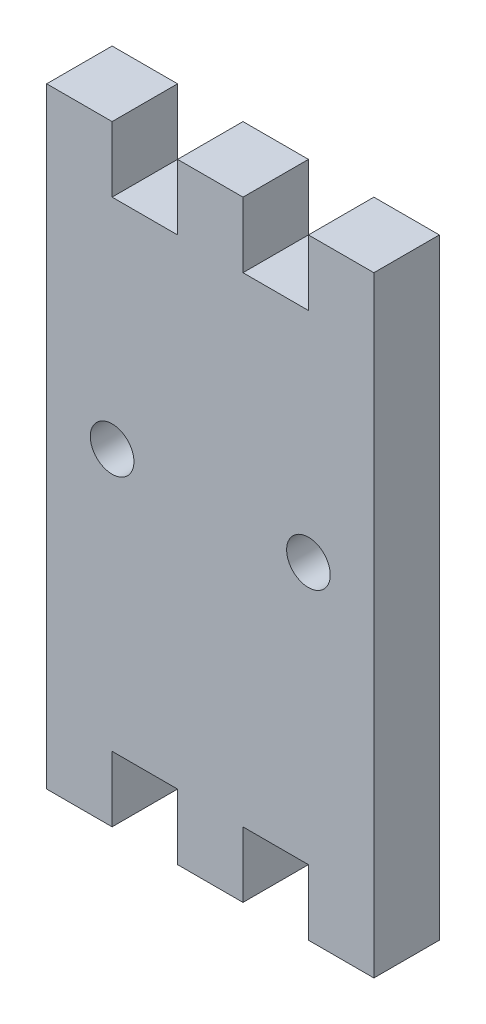
from build123d import *

# Parameters (mm, degrees)
SKETCH1_R           = 1
BOSS_EXTRUDE2_DEPTH = 3


with BuildPart() as part:
    # Sketch1 → Boss-Extrude2 (new body)
    with BuildSketch(Plane.XY):
        Polygon((-7.5, -14), (-4.5, -14), (-4.5, -11), (-1.5, -11), (-1.5, -14), (1.5, -14), (1.5, -11), (4.5, -11), (4.5, -14), (7.5, -14), (7.5, 14), (4.5, 14), (4.5, 11), (1.5, 11), (1.5, 14), (-1.5, 14), (-1.5, 11), (-4.5, 11), (-4.5, 14), (-7.5, 14), align=None)
        with Locations((-4.5, 1)):
            Circle(SKETCH1_R, mode=Mode.SUBTRACT)
        with Locations(Location((4.5, 1, 0), (0, 0, 180))):
            Circle(SKETCH1_R, mode=Mode.SUBTRACT)
    extrude(amount=BOSS_EXTRUDE2_DEPTH)


solid = part.part
